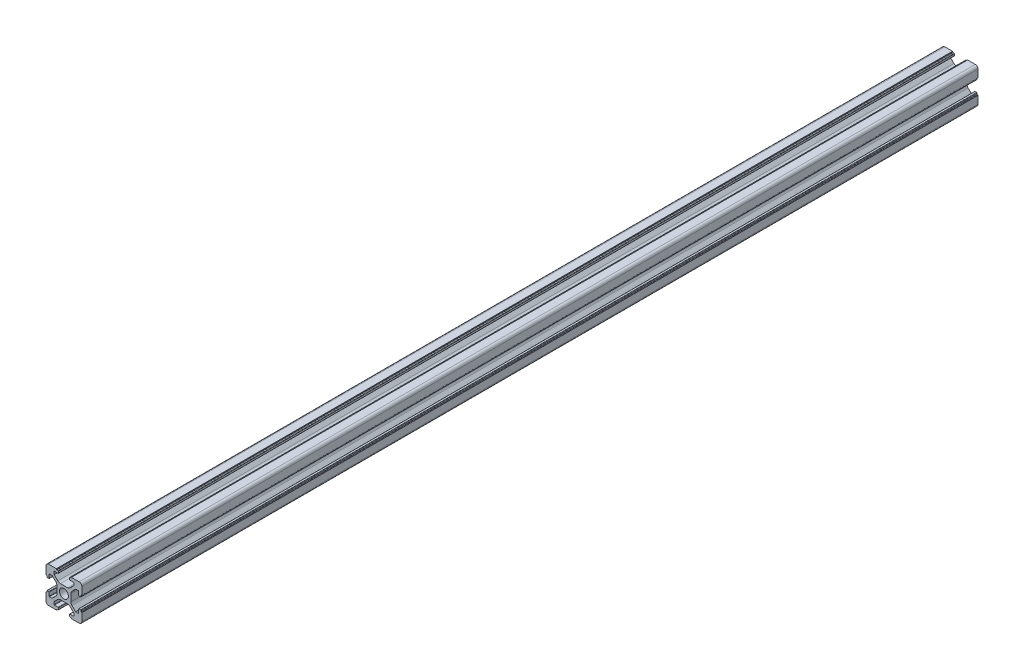
from build123d import *

# Parameters (mm, degrees)
SKETCH1_R           = 2.5
BOSS_EXTRUDE1_DEPTH = 500


with BuildPart() as part:
    # Sketch1 → Boss-Extrude1 (new body)
    with BuildSketch(Plane(origin=(0, 0, 0), x_dir=(1, 0, 0), z_dir=(0, 0, -1))):
        with BuildLine():
            Line((1.5, 0), (5.8, 0))
            ThreePointArc((5.8, 0), (5.870710678, 0.029289322), (5.9, 0.1))
            Line((5.9, 0.1), (5.9, 0.3))
            ThreePointArc((5.9, 0.3), (5.958578644, 0.441421356), (6.1, 0.5))
            Line((6.1, 0.5), (6.7, 0.5))
            ThreePointArc((6.7, 0.5), (6.841421356, 0.558578644), (6.9, 0.7))
            Line((6.9, 0.7), (6.9, 1.6))
            ThreePointArc((6.9, 1.6), (6.841421356, 1.741421356), (6.7, 1.8))
            Line((6.7, 1.8), (4.7, 1.8))
            ThreePointArc((4.7, 1.8), (4.558578644, 1.858578644), (4.5, 2))
            Line((4.5, 2), (4.5, 3.31507576))
            ThreePointArc((4.5, 3.31507576), (4.52283614, 3.429880789), (4.587867966, 3.527207794))
            Line((4.587867966, 3.527207794), (6.574873734, 5.514213562))
            ThreePointArc((6.574873734, 5.514213562), (7.223720432, 5.947759065), (7.989087297, 6.1))
            Line((7.989087297, 6.1), (12.010912703, 6.1))
            ThreePointArc((12.010912703, 6.1), (12.776279568, 5.947759065), (13.425126266, 5.514213562))
            Line((13.425126266, 5.514213562), (15.412132034, 3.527207794))
            ThreePointArc((15.412132034, 3.527207794), (15.47716386, 3.429880789), (15.5, 3.31507576))
            Line((15.5, 3.31507576), (15.5, 2))
            ThreePointArc((15.5, 2), (15.441421356, 1.858578644), (15.3, 1.8))
            Line((15.3, 1.8), (13.3, 1.8))
            ThreePointArc((13.3, 1.8), (13.158578644, 1.741421356), (13.1, 1.6))
            Line((13.1, 1.6), (13.1, 0.7))
            ThreePointArc((13.1, 0.7), (13.158578644, 0.558578644), (13.3, 0.5))
            Line((13.3, 0.5), (13.9, 0.5))
            ThreePointArc((13.9, 0.5), (14.041421356, 0.441421356), (14.1, 0.3))
            Line((14.1, 0.3), (14.1, 0.1))
            ThreePointArc((14.1, 0.1), (14.129289322, 0.029289322), (14.2, 0))
            Line((14.2, 0), (18.5, 0))
            ThreePointArc((18.5, 0), (19.560660172, 0.439339828), (20, 1.5))
            Line((20, 1.5), (20, 5.8))
            ThreePointArc((20, 5.8), (19.970710678, 5.870710678), (19.9, 5.9))
            Line((19.9, 5.9), (19.7, 5.9))
            ThreePointArc((19.7, 5.9), (19.558578644, 5.958578644), (19.5, 6.1))
            Line((19.5, 6.1), (19.5, 6.7))
            ThreePointArc((19.5, 6.7), (19.441421356, 6.841421356), (19.3, 6.9))
            Line((19.3, 6.9), (18.4, 6.9))
            ThreePointArc((18.4, 6.9), (18.258578644, 6.841421356), (18.2, 6.7))
            Line((18.2, 6.7), (18.2, 4.7))
            ThreePointArc((18.2, 4.7), (18.141421356, 4.558578644), (18, 4.5))
            Line((18, 4.5), (16.68492424, 4.5))
            ThreePointArc((16.68492424, 4.5), (16.570119211, 4.52283614), (16.472792206, 4.587867966))
            Line((16.472792206, 4.587867966), (14.485786438, 6.574873734))
            ThreePointArc((14.485786438, 6.574873734), (14.052240935, 7.223720432), (13.9, 7.989087297))
            Line((13.9, 7.989087297), (13.9, 12.010912703))
            ThreePointArc((13.9, 12.010912703), (14.052240935, 12.776279568), (14.485786438, 13.425126266))
            Line((14.485786438, 13.425126266), (16.472792206, 15.412132034))
            ThreePointArc((16.472792206, 15.412132034), (16.570119211, 15.47716386), (16.68492424, 15.5))
            Line((16.68492424, 15.5), (18, 15.5))
            ThreePointArc((18, 15.5), (18.141421356, 15.441421356), (18.2, 15.3))
            Line((18.2, 15.3), (18.2, 13.3))
            ThreePointArc((18.2, 13.3), (18.258578644, 13.158578644), (18.4, 13.1))
            Line((18.4, 13.1), (19.3, 13.1))
            ThreePointArc((19.3, 13.1), (19.441421356, 13.158578644), (19.5, 13.3))
            Line((19.5, 13.3), (19.5, 13.9))
            ThreePointArc((19.5, 13.9), (19.558578644, 14.041421356), (19.7, 14.1))
            Line((19.7, 14.1), (19.9, 14.1))
            ThreePointArc((19.9, 14.1), (19.970710678, 14.129289322), (20, 14.2))
            Line((20, 14.2), (20, 18.5))
            ThreePointArc((20, 18.5), (19.560660172, 19.560660172), (18.5, 20))
            Line((18.5, 20), (14.2, 20))
            ThreePointArc((14.2, 20), (14.129289322, 19.970710678), (14.1, 19.9))
            Line((14.1, 19.9), (14.1, 19.7))
            ThreePointArc((14.1, 19.7), (14.041421356, 19.558578644), (13.9, 19.5))
            Line((13.9, 19.5), (13.3, 19.5))
            ThreePointArc((13.3, 19.5), (13.158578644, 19.441421356), (13.1, 19.3))
            Line((13.1, 19.3), (13.1, 18.4))
            ThreePointArc((13.1, 18.4), (13.158578644, 18.258578644), (13.3, 18.2))
            Line((13.3, 18.2), (15.3, 18.2))
            ThreePointArc((15.3, 18.2), (15.441421356, 18.141421356), (15.5, 18))
            Line((15.5, 18), (15.5, 16.68492424))
            ThreePointArc((15.5, 16.68492424), (15.47716386, 16.570119211), (15.412132034, 16.472792206))
            Line((15.412132034, 16.472792206), (13.425126266, 14.485786438))
            ThreePointArc((13.425126266, 14.485786438), (12.776279568, 14.052240935), (12.010912703, 13.9))
            Line((12.010912703, 13.9), (7.989087297, 13.9))
            ThreePointArc((7.989087297, 13.9), (7.223720432, 14.052240935), (6.574873734, 14.485786438))
            Line((6.574873734, 14.485786438), (4.587867966, 16.472792206))
            ThreePointArc((4.587867966, 16.472792206), (4.52283614, 16.570119211), (4.5, 16.68492424))
            Line((4.5, 16.68492424), (4.5, 18))
            ThreePointArc((4.5, 18), (4.558578644, 18.141421356), (4.7, 18.2))
            Line((4.7, 18.2), (6.7, 18.2))
            ThreePointArc((6.7, 18.2), (6.841421356, 18.258578644), (6.9, 18.4))
            Line((6.9, 18.4), (6.9, 19.3))
            ThreePointArc((6.9, 19.3), (6.841421356, 19.441421356), (6.7, 19.5))
            Line((6.7, 19.5), (6.1, 19.5))
            ThreePointArc((6.1, 19.5), (5.958578644, 19.558578644), (5.9, 19.7))
            Line((5.9, 19.7), (5.9, 19.9))
            ThreePointArc((5.9, 19.9), (5.870710678, 19.970710678), (5.8, 20))
            Line((5.8, 20), (1.5, 20))
            ThreePointArc((1.5, 20), (0.439339828, 19.560660172), (0, 18.5))
            Line((0, 18.5), (0, 14.2))
            ThreePointArc((0, 14.2), (0.029289322, 14.129289322), (0.1, 14.1))
            Line((0.1, 14.1), (0.3, 14.1))
            ThreePointArc((0.3, 14.1), (0.441421356, 14.041421356), (0.5, 13.9))
            Line((0.5, 13.9), (0.5, 13.3))
            ThreePointArc((0.5, 13.3), (0.558578644, 13.158578644), (0.7, 13.1))
            Line((0.7, 13.1), (1.6, 13.1))
            ThreePointArc((1.6, 13.1), (1.741421356, 13.158578644), (1.8, 13.3))
            Line((1.8, 13.3), (1.8, 15.3))
            ThreePointArc((1.8, 15.3), (1.858578644, 15.441421356), (2, 15.5))
            Line((2, 15.5), (3.31507576, 15.5))
            ThreePointArc((3.31507576, 15.5), (3.429880789, 15.47716386), (3.527207794, 15.412132034))
            Line((3.527207794, 15.412132034), (5.514213562, 13.425126266))
            ThreePointArc((5.514213562, 13.425126266), (5.947759065, 12.776279568), (6.1, 12.010912703))
            Line((6.1, 12.010912703), (6.1, 7.989087297))
            ThreePointArc((6.1, 7.989087297), (5.947759065, 7.223720432), (5.514213562, 6.574873734))
            Line((5.514213562, 6.574873734), (3.527207794, 4.587867966))
            ThreePointArc((3.527207794, 4.587867966), (3.429880789, 4.52283614), (3.31507576, 4.5))
            Line((3.31507576, 4.5), (2, 4.5))
            ThreePointArc((2, 4.5), (1.858578644, 4.558578644), (1.8, 4.7))
            Line((1.8, 4.7), (1.8, 6.7))
            ThreePointArc((1.8, 6.7), (1.741421356, 6.841421356), (1.6, 6.9))
            Line((1.6, 6.9), (0.7, 6.9))
            ThreePointArc((0.7, 6.9), (0.558578644, 6.841421356), (0.5, 6.7))
            Line((0.5, 6.7), (0.5, 6.1))
            ThreePointArc((0.5, 6.1), (0.441421356, 5.958578644), (0.3, 5.9))
            Line((0.3, 5.9), (0.1, 5.9))
            ThreePointArc((0.1, 5.9), (0.029289322, 5.870710678), (0, 5.8))
            Line((0, 5.8), (0, 1.5))
            ThreePointArc((0, 1.5), (0.439339828, 0.439339828), (1.5, 0))
        make_face()
        with Locations(Location((10, 10, 0), (0, 0, 180))):
            Circle(SKETCH1_R, mode=Mode.SUBTRACT)
    extrude(amount=BOSS_EXTRUDE1_DEPTH)


solid = part.part
